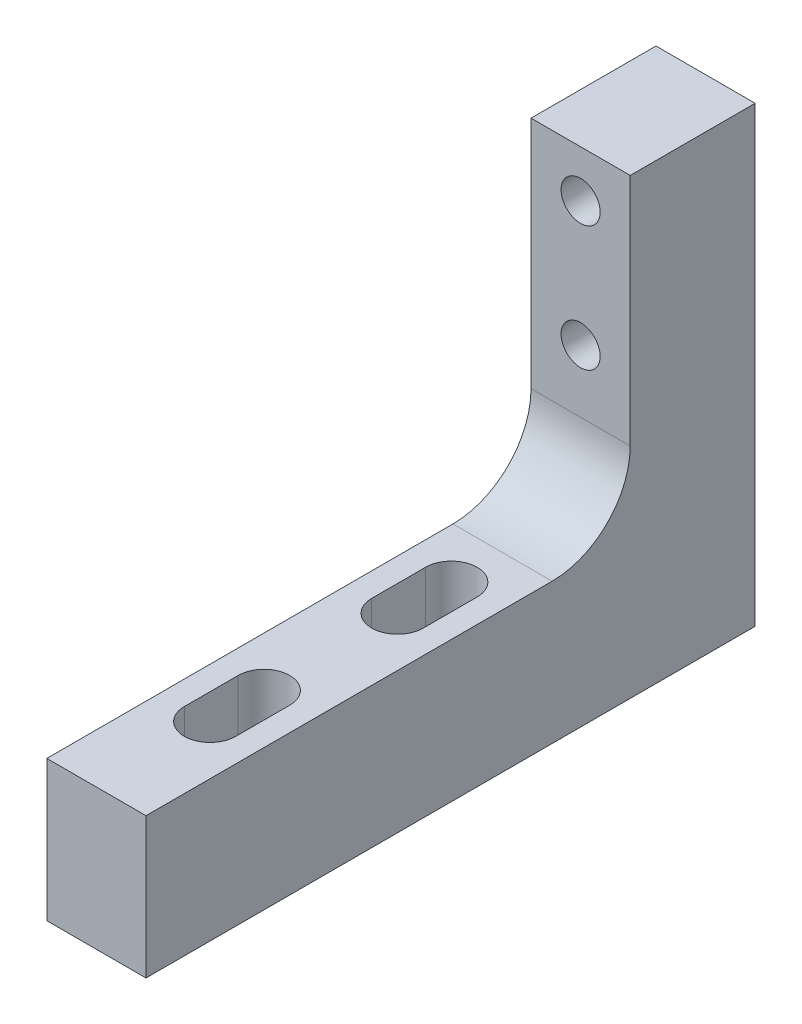
from build123d import *

# Parameters (mm, degrees)
BOSS_EXTRUDE1_DEPTH   = 6.35
M6_TAPPED_HOLE1_D     = 5
M6_TAPPED_HOLE1_DEPTH = 25.4
M6_TAPPED_HOLE1_TIP   = 1.502151548
M6_TAPPED_HOLE2_D     = 5
CUT_EXTRUDE1_DEPTH    = 88.888124909


with BuildPart() as part:
    # Sketch1 → Boss-Extrude1 (new, symmetric)
    with BuildSketch(Plane(origin=(0, 0, 0), x_dir=(0, 0, -1), z_dir=(1, 0, 0))):
        with BuildLine():
            Line((0, 0), (78, 0))
            Line((78, 0), (78, 58))
            Line((78, 58), (62, 58))
            Line((62, 58), (62, 28))
            ThreePointArc((62, 28), (59.071067812, 20.928932188), (52, 18))
            Line((52, 18), (0, 18))
            Line((0, 18), (0, 0))
        make_face()
    extrude(amount=BOSS_EXTRUDE1_DEPTH, both=True)

    # M6 Tapped Hole1
    with Locations(Plane(origin=(0, 0, -78), x_dir=(-1, 0, 0), z_dir=(0, 0, -1))):
        with Locations((0, 9), (0, 36)):
            Hole(M6_TAPPED_HOLE1_D / 2, depth=M6_TAPPED_HOLE1_DEPTH)
            with Locations((0, 0, -(M6_TAPPED_HOLE1_DEPTH + M6_TAPPED_HOLE1_TIP / 2))):  # 118° drill point
                Cone(0, M6_TAPPED_HOLE1_D / 2, M6_TAPPED_HOLE1_TIP, mode=Mode.SUBTRACT)

    # M6 Tapped Hole2 (through all)
    with Locations(Plane(origin=(0, 0, -78), x_dir=(-1, 0, 0), z_dir=(0, 0, -1))):
        with Locations((0, 52)):
            Hole(M6_TAPPED_HOLE2_D / 2)

    # Sketch4 → Cut-Extrude1 (cut, through all)
    with BuildSketch(Plane(origin=(0, 18, 0), x_dir=(1, 0, 0), z_dir=(0, 1, 0))):
        with BuildLine():
            Line((3.3, 45.45), (3.3, 38.55))
            ThreePointArc((3.3, 38.55), (0, 35.25), (-3.3, 38.55))
            Line((-3.3, 38.55), (-3.3, 45.45))
            ThreePointArc((-3.3, 45.45), (0, 48.75), (3.3, 45.45))
        make_face()
        with BuildLine():
            Line((3.3, 21.45), (3.3, 14.55))
            ThreePointArc((3.3, 14.55), (0, 11.25), (-3.3, 14.55))
            Line((-3.3, 14.55), (-3.3, 21.45))
            ThreePointArc((-3.3, 21.45), (0, 24.75), (3.3, 21.45))
        make_face()
    extrude(amount=-CUT_EXTRUDE1_DEPTH, mode=Mode.SUBTRACT)


solid = part.part
